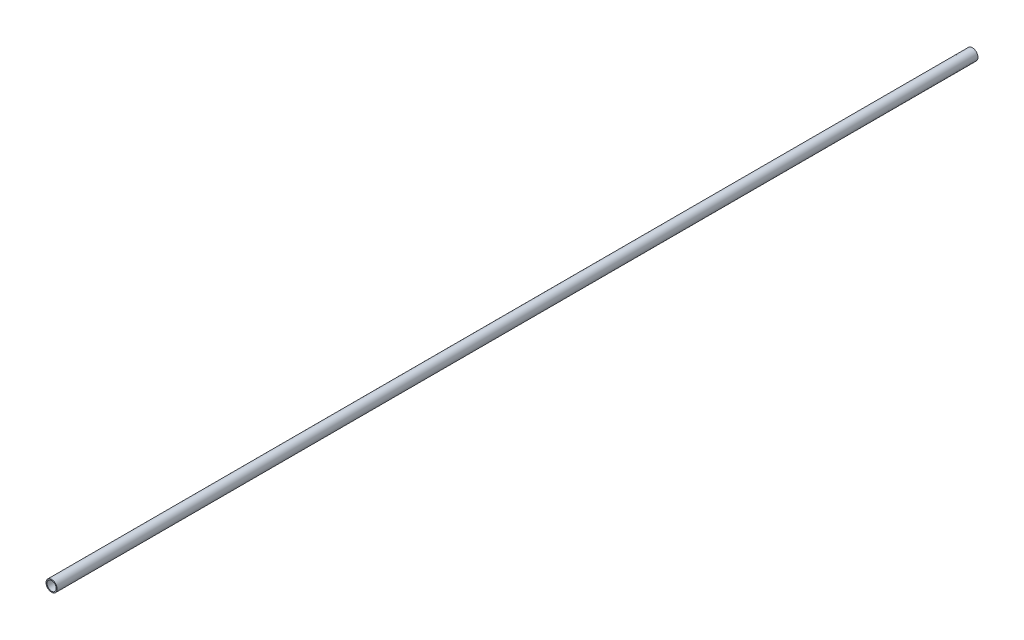
from build123d import *

# Parameters (mm, degrees)
SKETCH1_R           = 21.082
SKETCH1_R_2         = 17.526
BOSS_EXTRUDE1_DEPTH = 3473.45


with BuildPart() as part:
    # Sketch1 → Boss-Extrude1 (new body)
    with BuildSketch(Plane.XY):
        Circle(SKETCH1_R)
        Circle(SKETCH1_R_2, mode=Mode.SUBTRACT)
    extrude(amount=BOSS_EXTRUDE1_DEPTH)


solid = part.part
